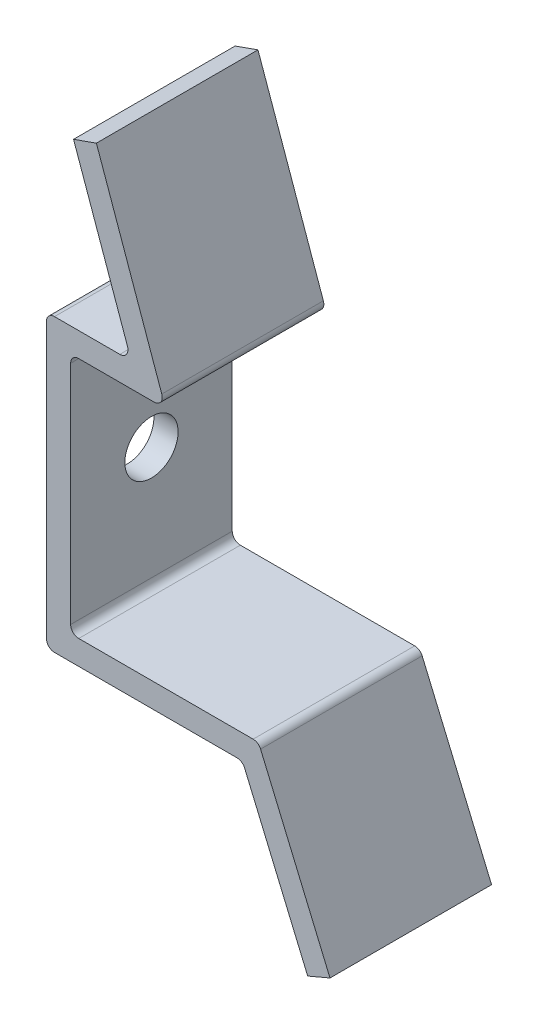
from build123d import *

# Parameters (mm, degrees)
EXTRUDE_1_DEPTH      = 10
EXTRUDE_1_DEPTH_BACK = 10
HOLE_WIZARD_M61_D    = 6.6


with BuildPart() as part:
    # Эскиз1 → Бобышка-Вытянуть1 (new, two sides: drawn at the far end of the back side and taken through both)
    with BuildSketch(Plane.XY.offset(-EXTRUDE_1_DEPTH_BACK)):
        with BuildLine():
            Line((0, 17), (0, -17))
            ThreePointArc((0, -17), (0.292893219, -17.707106781), (1, -18))
            Line((1, -18), (23.602457755, -18))
            ThreePointArc((23.602457755, -18), (24.154394741, -18.166114178), (24.522962609, -18.609268872))
            Line((24.522962609, -18.609268872), (32.337585178, -37.019365941))
            Line((32.337585178, -37.019365941), (35.099099739, -35.847172555))
            Line((35.099099739, -35.847172555), (26.508619292, -15.609268872))
            ThreePointArc((26.508619292, -15.609268872), (26.140051424, -15.166114178), (25.588114439, -15))
            Line((25.588114439, -15), (4, -15))
            ThreePointArc((4, -15), (3.292893219, -14.707106781), (3, -14))
            Line((3, -14), (3, 14))
            ThreePointArc((3, 14), (3.292893219, 14.707106781), (4, 15))
            Line((4, 15), (13.335032728, 15))
            ThreePointArc((13.335032728, 15), (14.151674283, 15.42285481), (14.277674219, 16.333806859))
            Line((14.277674219, 16.333806859), (6.184559691, 39.188057259))
            Line((6.184559691, 39.188057259), (3.356635218, 38.186636681))
            Line((3.356635218, 38.186636681), (10.032772403, 19.333806859))
            ThreePointArc((10.032772403, 19.333806859), (9.906772467, 18.42285481), (9.090130912, 18))
            Line((9.090130912, 18), (1, 18))
            ThreePointArc((1, 18), (0.292893219, 17.707106781), (0, 17))
        make_face()
    extrude(amount=EXTRUDE_1_DEPTH + EXTRUDE_1_DEPTH_BACK)

    # Отверстие с зазором M61 (through all)
    with Locations(Plane(origin=(0, 0, 0), x_dir=(0, -1, 0), z_dir=(-1, 0, 0))):
        with Locations((0, 0)):
            Hole(HOLE_WIZARD_M61_D / 2)


solid = part.part
